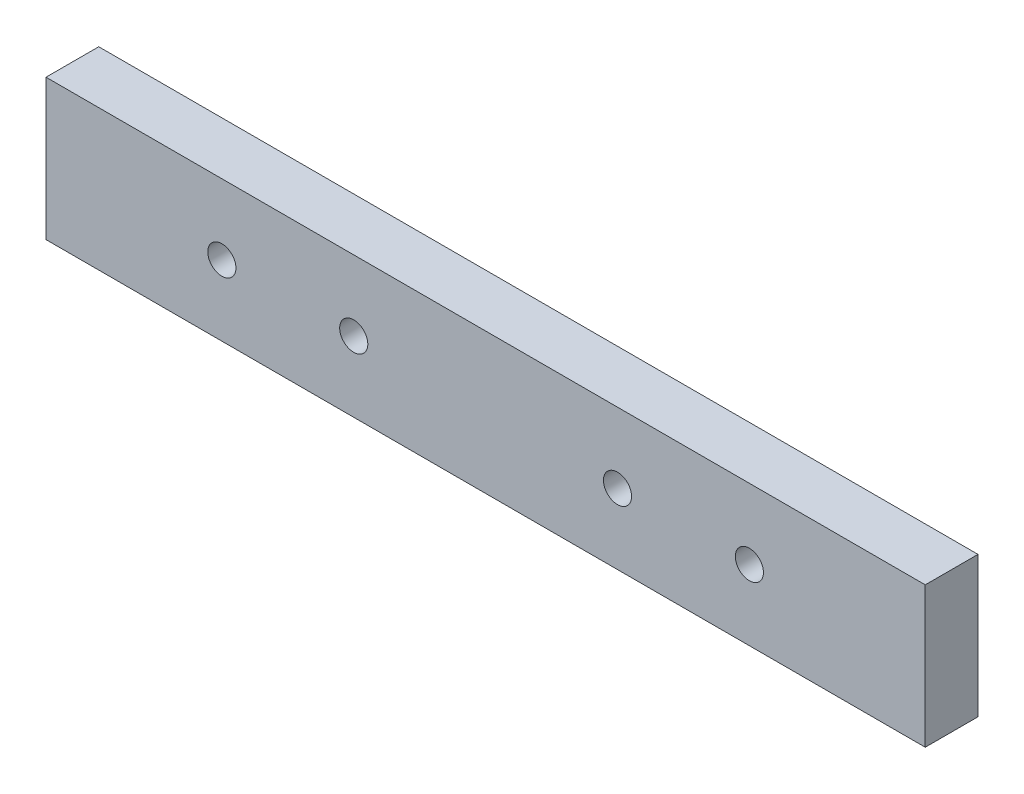
from build123d import *

# Parameters (mm, degrees)
SKETCH_1_W      = 100
SKETCH_1_H      = 16
SKETCH_1_R      = 1.6
EXTRUDE_1_DEPTH = 6


with BuildPart() as part:
    # ｽｹｯﾁ1 → ﾎﾞｽ - 押し出し1 (new body)
    with BuildSketch(Plane.XY):
        Rectangle(SKETCH_1_W, SKETCH_1_H)
        with Locations((30, 0)):
            Circle(SKETCH_1_R, mode=Mode.SUBTRACT)
        with Locations((15, 0)):
            Circle(SKETCH_1_R, mode=Mode.SUBTRACT)
        with Locations(Location((-30, 0, 0), (0, 0, 180))):
            Circle(SKETCH_1_R, mode=Mode.SUBTRACT)
        with Locations(Location((-15, 0, 0), (0, 0, 180))):
            Circle(SKETCH_1_R, mode=Mode.SUBTRACT)
    extrude(amount=EXTRUDE_1_DEPTH)


solid = part.part
